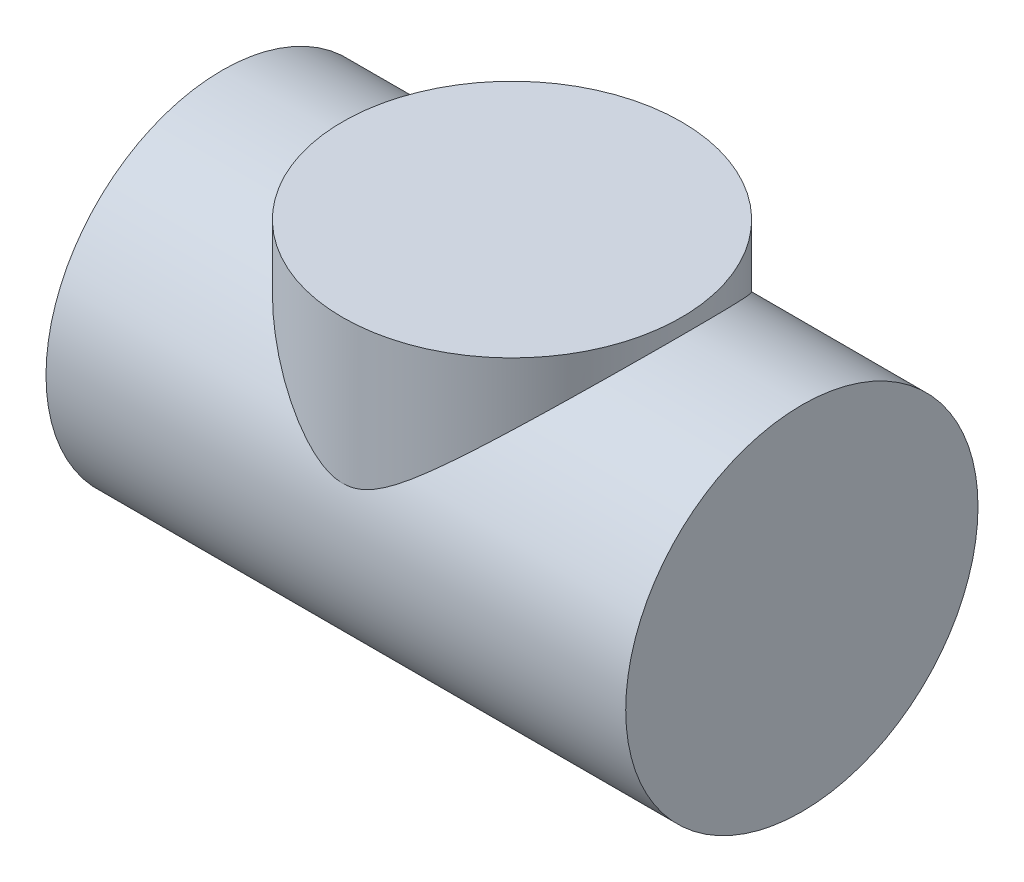
from build123d import *

# Parameters (mm, degrees)
BOSS_EXTRUDE1_START = -0.065
SKETCH1_R           = 0.0395
BOSS_EXTRUDE1_DEPTH = 0.13
SKETCH2_R           = 0.038
BOSS_EXTRUDE2_DEPTH = 0.043


with BuildPart() as part:
    # Sketch1 → Boss-Extrude1 (new body)
    with BuildSketch(Plane(origin=(0, 0, 0), x_dir=(0, 0, -1), z_dir=(1, 0, 0)).offset(BOSS_EXTRUDE1_START)):
        Circle(SKETCH1_R)
    extrude(amount=BOSS_EXTRUDE1_DEPTH)

    # Sketch2 → Boss-Extrude2 (add)
    with BuildSketch(Plane(origin=(0, 0, 0), x_dir=(1, 0, 0), z_dir=(0, 1, 0))):
        with Locations(Location((0, 0, 0), (0, 0, 90))):
            Circle(SKETCH2_R)
    extrude(amount=BOSS_EXTRUDE2_DEPTH)


solid = part.part
